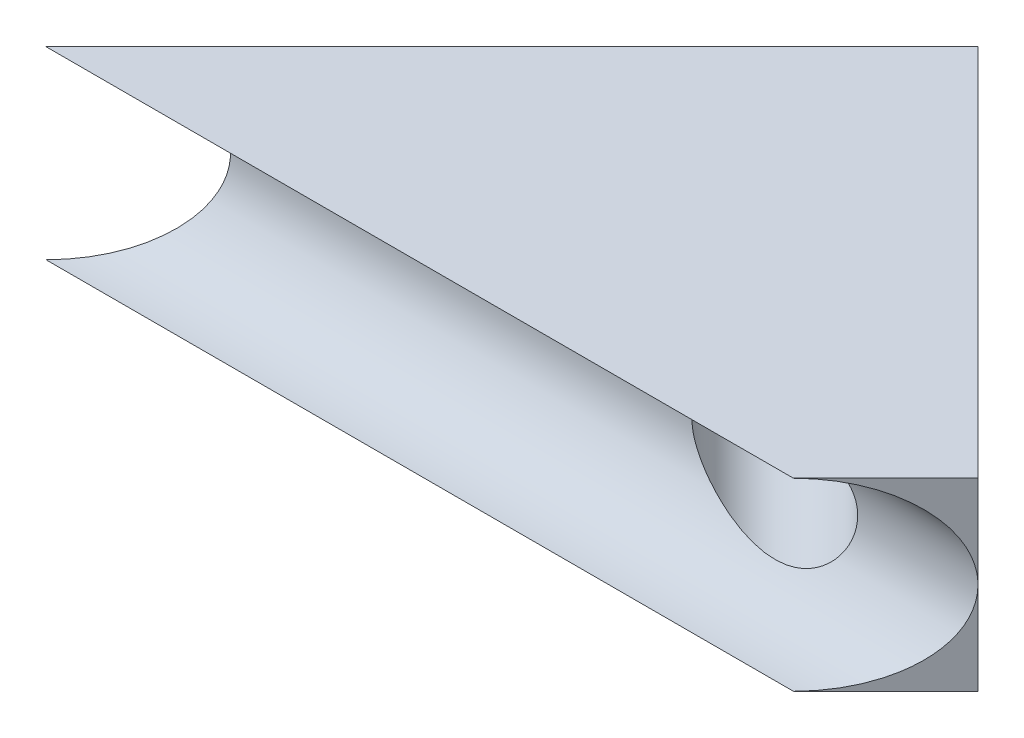
from build123d import *

# Parameters (mm, degrees)
BOSS_EXTRUDE1_DEPTH = 70
CUT_EXTRUDE1_DEPTH  = 402
CUT_EXTRUDE3_DEPTH  = 164
SKETCH5_R           = 22.231226606
CUT_EXTRUDE4_DEPTH  = 251


with BuildPart() as part:
    # Sketch1 → Boss-Extrude1 (new body)
    with BuildSketch(Plane(origin=(0, 0, 0), x_dir=(1, 0, 0), z_dir=(0, 1, 0))):
        Polygon((0, 0), (353.553390593, 0), (176.776695297, 176.776695297), align=None)
    extrude(amount=BOSS_EXTRUDE1_DEPTH)

    # Sketch3 → Cut-Extrude1 (cut)
    with BuildSketch(Plane(origin=(0, 0, 0), x_dir=(0, 0, -1), z_dir=(1, 0, 0))):
        with BuildLine():
            Line((0, 70), (0, 0))
            ThreePointArc((0, 0), (35, 35), (0, 70))
        make_face()
    extrude(amount=CUT_EXTRUDE1_DEPTH, mode=Mode.SUBTRACT)

    # Sketch4 → Cut-Extrude3 (cut)
    with BuildSketch(Plane.XZ):
        Polygon((318.553390593, -35), (283.553390593, 0), (353.553390593, 0), align=None)
    extrude(amount=-CUT_EXTRUDE3_DEPTH, mode=Mode.SUBTRACT)

    # Sketch5 → Cut-Extrude4 (cut)
    with BuildSketch(Plane(origin=(0, 0, 0), x_dir=(-0.7071067811865462, 0, 0.7071067811865489), z_dir=(-0.7071067811865489, 0, -0.7071067811865462))):
        with Locations((-195.507283553, 35)):
            Circle(SKETCH5_R)
    extrude(amount=-CUT_EXTRUDE4_DEPTH, mode=Mode.SUBTRACT)


solid = part.part
